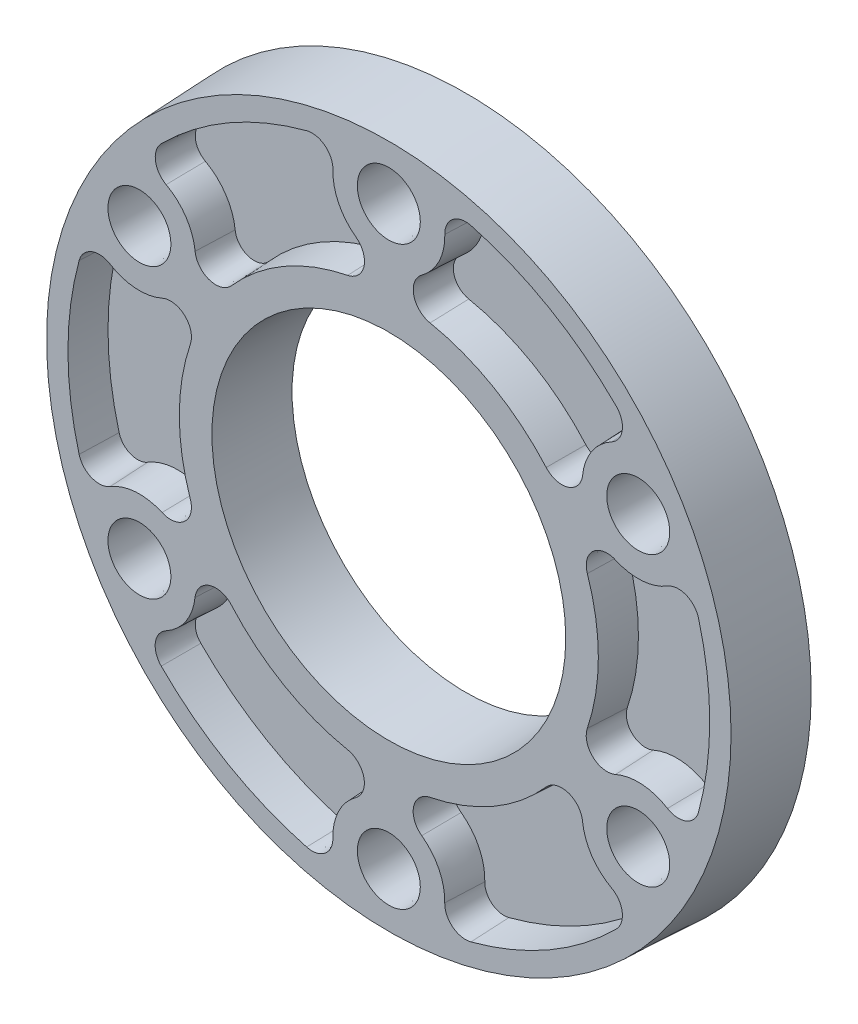
from build123d import *

# Parameters (mm, degrees)
CUT_EXTRUDE1_DEPTH = 3.175
CUT_EXTRUDE1_DRAFT = -2.499999997
CUT_EXTRUDE2_DEPTH = 3.175
CUT_EXTRUDE2_DRAFT = -2.499999997
CUT_EXTRUDE3_DEPTH = 3.175
CUT_EXTRUDE3_DRAFT = -2.499999997
CUT_EXTRUDE4_DEPTH = 3.175
CUT_EXTRUDE4_DRAFT = -2.499999997
CUT_EXTRUDE5_DEPTH = 3.175
CUT_EXTRUDE5_DRAFT = -2.499999997
CUT_EXTRUDE6_DEPTH = 3.175
CUT_EXTRUDE6_DRAFT = -2.499999997


with BuildPart() as part:
    # Sketch1 → Revolve1 (revolve)
    with BuildSketch(Plane(origin=(0, 0, 0), x_dir=(1, 0, 0), z_dir=(0, 1, 0))):
        Polygon((28.575, 3.175), (0, 3.175), (0, -3.175), (28.297753013, -3.175), align=None)
    revolve(axis=Axis((0, 0, -3.175), (0, 0, 1)))


with BuildPart() as cut_extrude1_tool:
    # Sketch2 → Cut-Extrude1 (with draft: the straight prism first)
    with BuildSketch(Plane.XY.offset(3.175)):
        with BuildLine():
            ThreePointArc((-18.412322915, 15.975071512), (-16.774840019, 14.48240768), (-16.018385207, 12.399819948))
            ThreePointArc((-16.018385207, 12.399819948), (-14.824369054, 10.938604706), (-13.006181472, 11.443598242))
            ThreePointArc((-13.006181472, 11.443598242), (-8.658542341, 15.004877265), (-3.399666872, 16.987023352))
            ThreePointArc((-3.399666872, 16.987023352), (-2.052383538, 18.309669286), (-2.722192076, 20.074866491))
            ThreePointArc((-2.722192076, 20.074866491), (-4.148376637, 21.770147136), (-4.622272981, 23.934263844))
            ThreePointArc((-4.622272981, 23.934263844), (-5.27701362, 25.333574104), (-6.789514671, 25.648367816))
            ThreePointArc((-6.789514671, 25.648367816), (-13.262833976, 22.978979873), (-18.812390624, 18.709095117))
            ThreePointArc((-18.812390624, 18.709095117), (-19.296416457, 17.241985352), (-18.412322915, 15.975071512))
        make_face()
    extrude(amount=-CUT_EXTRUDE1_DEPTH)
    # Cut-Extrude1: the draft: its side faces are tilted about the plane it starts from
    cut_extrude1_sides = [cut_extrude1_tool.faces().sort_by_distance(p)[0] for p in [
        (-19.296416457, 17.241985352, 1.5875),
        (-16.774840019, 14.48240768, 1.5875),
        (-14.824369054, 10.938604706, 1.5875),
        (-8.658542341, 15.004877265, 1.5875),
        (-2.052383538, 18.309669286, 1.5875),
        (-4.148376637, 21.770147136, 1.5875),
        (-5.27701362, 25.333574104, 1.5875),
        (-13.262833976, 22.978979873, 1.5875),
    ]]
    draft(cut_extrude1_sides, Plane.XY.offset(3.175), CUT_EXTRUDE1_DRAFT)


with BuildPart() as part_1:
    add(part.part)

    # Cut-Extrude1: cut by cut_extrude1_tool
    add(cut_extrude1_tool.part, mode=Mode.SUBTRACT)


with BuildPart() as cut_extrude2_tool:
    # Sketch3 → Cut-Extrude2 (with draft: the straight prism first)
    with BuildSketch(Plane.XY.offset(3.175)):
        with BuildLine():
            ThreePointArc((4.628656299, 23.933075143), (4.15471295, 21.768641441), (2.729366473, 20.072238491))
            ThreePointArc((2.729366473, 20.072238491), (2.06092503, 18.307582549), (3.407356052, 16.985482682))
            ThreePointArc((3.407356052, 16.985482682), (8.665333722, 15.000956259), (13.011360321, 11.437709552))
            ThreePointArc((13.011360321, 11.437709552), (14.830446967, 10.932250925), (16.024248321, 12.394920737))
            ThreePointArc((16.024248321, 12.394920737), (16.779312145, 14.47767312), (18.416544019, 15.970137747))
            ThreePointArc((18.416544019, 15.970137747), (19.301011933, 17.236814903), (18.817380759, 18.704076092))
            ThreePointArc((18.817380759, 18.704076092), (13.268963335, 22.975441086), (6.796356341, 25.646555745))
            ThreePointArc((6.796356341, 25.646555745), (5.283789098, 25.33217953), (4.628656299, 23.933075143))
        make_face()
    extrude(amount=-CUT_EXTRUDE2_DEPTH)
    # Cut-Extrude2: the draft: its side faces are tilted about the plane it starts from
    cut_extrude2_sides = [cut_extrude2_tool.faces().sort_by_distance(p)[0] for p in [
        (5.283789098, 25.33217953, 1.5875),
        (4.15471295, 21.768641441, 1.5875),
        (2.06092503, 18.307582549, 1.5875),
        (8.665333722, 15.000956259, 1.5875),
        (14.830446967, 10.932250925, 1.5875),
        (16.779312145, 14.47767312, 1.5875),
        (19.301011933, 17.236814903, 1.5875),
        (13.268963335, 22.975441086, 1.5875),
    ]]
    draft(cut_extrude2_sides, Plane.XY.offset(3.175), CUT_EXTRUDE2_DRAFT)


with BuildPart() as part_2:
    add(part_1.part)

    # Cut-Extrude2: cut by cut_extrude2_tool
    add(cut_extrude2_tool.part, mode=Mode.SUBTRACT)


with BuildPart() as cut_extrude3_tool:
    # Sketch4 → Cut-Extrude3 (with draft: the straight prism first)
    with BuildSketch(Plane.XY.offset(3.175)):
        with BuildLine():
            ThreePointArc((23.040979214, 7.958003631), (20.929552969, 7.286233761), (18.747751681, 7.672418543))
            ThreePointArc((18.747751681, 7.672418543), (16.885294085, 7.368977843), (16.413537524, 5.54188444))
            ThreePointArc((16.413537524, 5.54188444), (17.323876063, -0.003921006), (16.411027194, -5.5493138))
            ThreePointArc((16.411027194, -5.5493138), (16.882830505, -7.377418361), (18.746440396, -7.679945754))
            ThreePointArc((18.746440396, -7.679945754), (20.927688782, -7.292474016), (23.038817, -7.964126097))
            ThreePointArc((23.038817, -7.964126097), (24.578025553, -8.096759201), (25.60689543, -6.944291723))
            ThreePointArc((25.60689543, -6.944291723), (26.531797311, -0.003538787), (25.608746965, 6.937460628))
            ThreePointArc((25.608746965, 6.937460628), (24.580205555, 8.090194178), (23.040979214, 7.958003631))
        make_face()
    extrude(amount=-CUT_EXTRUDE3_DEPTH)
    # Cut-Extrude3: the draft: its side faces are tilted about the plane it starts from
    cut_extrude3_sides = [cut_extrude3_tool.faces().sort_by_distance(p)[0] for p in [
        (26.531797311, -0.003538787, 1.5875),
        (24.580205555, 8.090194178, 1.5875),
        (20.929552969, 7.286233761, 1.5875),
        (16.885294085, 7.368977843, 1.5875),
        (17.323876063, -0.003921006, 1.5875),
        (16.882830505, -7.377418361, 1.5875),
        (20.927688782, -7.292474016, 1.5875),
        (24.578025553, -8.096759201, 1.5875),
    ]]
    draft(cut_extrude3_sides, Plane.XY.offset(3.175), CUT_EXTRUDE3_DRAFT)


with BuildPart() as part_3:
    add(part_2.part)

    # Cut-Extrude3: cut by cut_extrude3_tool
    add(cut_extrude3_tool.part, mode=Mode.SUBTRACT)


with BuildPart() as cut_extrude4_tool:
    # Sketch5 → Cut-Extrude4 (with draft: the straight prism first)
    with BuildSketch(Plane.XY.offset(3.175)):
        with BuildLine():
            ThreePointArc((18.412322915, -15.975071512), (16.774840019, -14.48240768), (16.018385207, -12.399819948))
            ThreePointArc((16.018385207, -12.399819948), (14.824369054, -10.938604706), (13.006181472, -11.443598242))
            ThreePointArc((13.006181472, -11.443598242), (8.658542341, -15.004877265), (3.399666872, -16.987023352))
            ThreePointArc((3.399666872, -16.987023352), (2.052383538, -18.309669286), (2.722192076, -20.074866491))
            ThreePointArc((2.722192076, -20.074866491), (4.148376637, -21.770147136), (4.622272981, -23.934263844))
            ThreePointArc((4.622272981, -23.934263844), (5.27701362, -25.333574104), (6.789514671, -25.648367816))
            ThreePointArc((6.789514671, -25.648367816), (13.262833976, -22.978979873), (18.812390624, -18.709095117))
            ThreePointArc((18.812390624, -18.709095117), (19.296416457, -17.241985352), (18.412322915, -15.975071512))
        make_face()
    extrude(amount=-CUT_EXTRUDE4_DEPTH)
    # Cut-Extrude4: the draft: its side faces are tilted about the plane it starts from
    cut_extrude4_sides = [cut_extrude4_tool.faces().sort_by_distance(p)[0] for p in [
        (19.296416457, -17.241985352, 1.5875),
        (16.774840019, -14.48240768, 1.5875),
        (14.824369054, -10.938604706, 1.5875),
        (8.658542341, -15.004877265, 1.5875),
        (2.052383538, -18.309669286, 1.5875),
        (4.148376637, -21.770147136, 1.5875),
        (5.27701362, -25.333574104, 1.5875),
        (13.262833976, -22.978979873, 1.5875),
    ]]
    draft(cut_extrude4_sides, Plane.XY.offset(3.175), CUT_EXTRUDE4_DRAFT)


with BuildPart() as part_4:
    add(part_3.part)

    # Cut-Extrude4: cut by cut_extrude4_tool
    add(cut_extrude4_tool.part, mode=Mode.SUBTRACT)


with BuildPart() as cut_extrude5_tool:
    # Sketch6 → Cut-Extrude5 (with draft: the straight prism first)
    with BuildSketch(Plane.XY.offset(3.175)):
        with BuildLine():
            ThreePointArc((-4.628656299, -23.933075143), (-4.15471295, -21.768641441), (-2.729366473, -20.072238491))
            ThreePointArc((-2.729366473, -20.072238491), (-2.06092503, -18.307582549), (-3.407356052, -16.985482682))
            ThreePointArc((-3.407356052, -16.985482682), (-8.665333722, -15.000956259), (-13.011360321, -11.437709552))
            ThreePointArc((-13.011360321, -11.437709552), (-14.830446967, -10.932250925), (-16.024248321, -12.394920737))
            ThreePointArc((-16.024248321, -12.394920737), (-16.779312145, -14.47767312), (-18.416544019, -15.970137747))
            ThreePointArc((-18.416544019, -15.970137747), (-19.301011933, -17.236814903), (-18.817380759, -18.704076092))
            ThreePointArc((-18.817380759, -18.704076092), (-13.268963335, -22.975441086), (-6.796356341, -25.646555745))
            ThreePointArc((-6.796356341, -25.646555745), (-5.283789098, -25.33217953), (-4.628656299, -23.933075143))
        make_face()
    extrude(amount=-CUT_EXTRUDE5_DEPTH)
    # Cut-Extrude5: the draft: its side faces are tilted about the plane it starts from
    cut_extrude5_sides = [cut_extrude5_tool.faces().sort_by_distance(p)[0] for p in [
        (-13.268963335, -22.975441086, 1.5875),
        (-5.283789098, -25.33217953, 1.5875),
        (-4.15471295, -21.768641441, 1.5875),
        (-2.06092503, -18.307582549, 1.5875),
        (-8.665333722, -15.000956259, 1.5875),
        (-14.830446967, -10.932250925, 1.5875),
        (-16.779312145, -14.47767312, 1.5875),
        (-19.301011933, -17.236814903, 1.5875),
    ]]
    draft(cut_extrude5_sides, Plane.XY.offset(3.175), CUT_EXTRUDE5_DRAFT)


with BuildPart() as part_5:
    add(part_4.part)

    # Cut-Extrude5: cut by cut_extrude5_tool
    add(cut_extrude5_tool.part, mode=Mode.SUBTRACT)


with BuildPart() as cut_extrude6_tool:
    # Sketch7 → Cut-Extrude6 (with draft: the straight prism first)
    with BuildSketch(Plane.XY.offset(3.175)):
        with BuildLine():
            ThreePointArc((-23.040979214, -7.958003631), (-20.929552969, -7.286233761), (-18.747751681, -7.672418543))
            ThreePointArc((-18.747751681, -7.672418543), (-16.885294085, -7.368977843), (-16.413537524, -5.54188444))
            ThreePointArc((-16.413537524, -5.54188444), (-17.323876063, 0.003921006), (-16.411027194, 5.5493138))
            ThreePointArc((-16.411027194, 5.5493138), (-16.882830505, 7.377418361), (-18.746440396, 7.679945754))
            ThreePointArc((-18.746440396, 7.679945754), (-20.927688782, 7.292474016), (-23.038817, 7.964126097))
            ThreePointArc((-23.038817, 7.964126097), (-24.578025553, 8.096759201), (-25.60689543, 6.944291723))
            ThreePointArc((-25.60689543, 6.944291723), (-26.531797311, 0.003538787), (-25.608746965, -6.937460628))
            ThreePointArc((-25.608746965, -6.937460628), (-24.580205555, -8.090194178), (-23.040979214, -7.958003631))
        make_face()
    extrude(amount=-CUT_EXTRUDE6_DEPTH)
    # Cut-Extrude6: the draft: its side faces are tilted about the plane it starts from
    cut_extrude6_sides = [cut_extrude6_tool.faces().sort_by_distance(p)[0] for p in [
        (-24.580205555, -8.090194178, 1.5875),
        (-20.929552969, -7.286233761, 1.5875),
        (-16.885294085, -7.368977843, 1.5875),
        (-17.323876063, 0.003921006, 1.5875),
        (-16.882830505, 7.377418361, 1.5875),
        (-20.927688782, 7.292474016, 1.5875),
        (-24.578025553, 8.096759201, 1.5875),
        (-26.531797311, 0.003538787, 1.5875),
    ]]
    draft(cut_extrude6_sides, Plane.XY.offset(3.175), CUT_EXTRUDE6_DRAFT)


with BuildPart() as part_6:
    add(part_5.part)

    # Cut-Extrude6: cut by cut_extrude6_tool
    add(cut_extrude6_tool.part, mode=Mode.SUBTRACT)

    # Sketch8 → Hole1 (revolve, cut)
    with BuildSketch(Plane(origin=(0, 23.8125, 3.175), x_dir=(0, -1, 0), z_dir=(1, 0, 0))):
        Polygon((0, 0), (0, 6.35), (2.381753114, 6.35), (2.6035, 0), align=None)
    revolve(axis=Axis((0, 23.8125, -106.825), (0, 0, 1)), mode=Mode.SUBTRACT)

    # Sketch10 → Hole2 (revolve, cut)
    with BuildSketch(Plane(origin=(-20.622229928, -11.90625, 3.175), x_dir=(0, -1, 0), z_dir=(1, 0, 0))):
        Polygon((0, 0), (0, 6.35), (2.326253013, 6.35), (2.6035, 0), align=None)
    revolve(axis=Axis((-20.622229928, -11.90625, -106.825), (0, 0, 1)), mode=Mode.SUBTRACT)

    # Sketch12 → Hole3 (revolve, cut)
    with BuildSketch(Plane(origin=(0, -23.8125, 3.175), x_dir=(0, -1, 0), z_dir=(1, 0, 0))):
        Polygon((0, 0), (0, 6.35), (2.326253013, 6.35), (2.6035, 0), align=None)
    revolve(axis=Axis((0, -23.8125, -106.825), (0, 0, 1)), mode=Mode.SUBTRACT)

    # Sketch14 → Hole4 (revolve, cut)
    with BuildSketch(Plane(origin=(20.622229928, -11.90625, 3.175), x_dir=(0, -1, 0), z_dir=(1, 0, 0))):
        Polygon((0, 0), (0, 6.35), (2.326253013, 6.35), (2.6035, 0), align=None)
    revolve(axis=Axis((20.622229928, -11.90625, -106.825), (0, 0, 1)), mode=Mode.SUBTRACT)

    # Sketch16 → Hole5 (revolve, cut)
    with BuildSketch(Plane(origin=(20.622229928, 11.90625, 3.175), x_dir=(0, -1, 0), z_dir=(1, 0, 0))):
        Polygon((0, 0), (0, 6.35), (2.326253013, 6.35), (2.6035, 0), align=None)
    revolve(axis=Axis((20.622229928, 11.90625, -106.825), (0, 0, 1)), mode=Mode.SUBTRACT)

    # Sketch18 → Hole6 (revolve, cut)
    with BuildSketch(Plane(origin=(0, 0, 3.175), x_dir=(0, -1, 0), z_dir=(1, 0, 0))):
        Polygon((0, 0), (0, 6.35), (14.351, 6.35), (14.628246987, 0), align=None)
    revolve(axis=Axis((0, 0, -106.825), (0, 0, 1)), mode=Mode.SUBTRACT)

    # Sketch20 → Hole7 (revolve, cut)
    with BuildSketch(Plane(origin=(-20.622229928, 11.90625, 3.175), x_dir=(0, -1, 0), z_dir=(1, 0, 0))):
        Polygon((0, 0), (0, 6.35), (2.381753114, 6.35), (2.6035, 0), align=None)
    revolve(axis=Axis((-20.622229928, 11.90625, -106.825), (0, 0, 1)), mode=Mode.SUBTRACT)


solid = part_6.part
